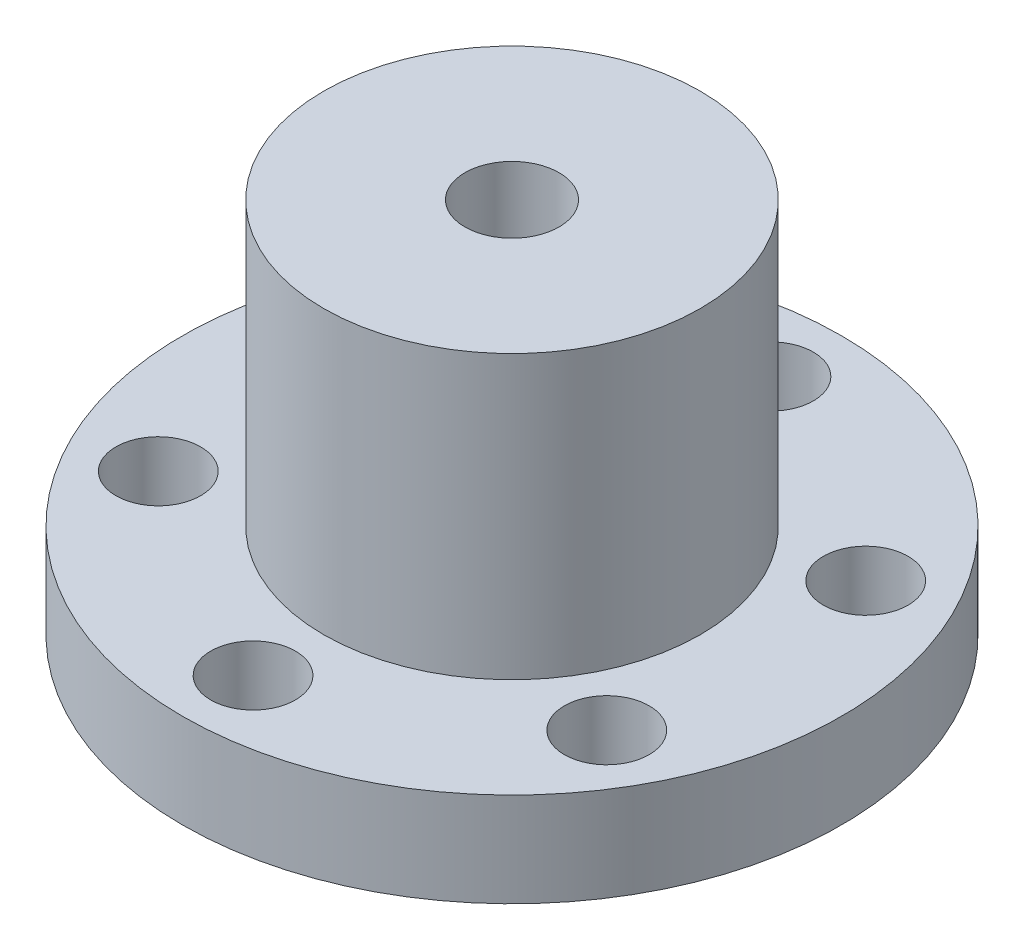
from build123d import *

# Parameters (mm, degrees)
SKETCH2_R           = 17.5
SKETCH2_R_2         = 2.25
BOSS_EXTRUDE1_DEPTH = 5
SKETCH3_R           = 10
BOSS_EXTRUDE2_DEPTH = 15
SKETCH4_R           = 2.5
CUT_EXTRUDE1_DEPTH  = 32.819805153


with BuildPart() as part:
    # Sketch2 → Boss-Extrude1 (new body)
    with BuildSketch(Plane(origin=(0, 0, 0), x_dir=(1, 0, 0), z_dir=(0, 1, 0))):
        with Locations(Location((0, 0, 0), (0, 0, 270))):
            Circle(SKETCH2_R)
        with Locations(Location((0, 13.75, 0), (0, 0, 270))):
            Circle(SKETCH2_R_2, mode=Mode.SUBTRACT)
        with Locations(Location((11.907849302, 6.875, 0), (0, 0, 270))):
            Circle(SKETCH2_R_2, mode=Mode.SUBTRACT)
        with Locations(Location((11.907849302, -6.875, 0), (0, 0, 270))):
            Circle(SKETCH2_R_2, mode=Mode.SUBTRACT)
        with Locations(Location((0, -13.75, 0), (0, 0, 270))):
            Circle(SKETCH2_R_2, mode=Mode.SUBTRACT)
        with Locations(Location((-11.907849302, -6.875, 0), (0, 0, 270))):
            Circle(SKETCH2_R_2, mode=Mode.SUBTRACT)
        with Locations(Location((-11.907849302, 6.875, 0), (0, 0, 270))):
            Circle(SKETCH2_R_2, mode=Mode.SUBTRACT)
    extrude(amount=BOSS_EXTRUDE1_DEPTH)

    # Sketch3 → Boss-Extrude2 (add)
    with BuildSketch(Plane(origin=(0, 5, 0), x_dir=(1, 0, 0), z_dir=(0, 1, 0))):
        with Locations(Location((0, 0, 0), (0, 0, 270))):
            Circle(SKETCH3_R)
    extrude(amount=BOSS_EXTRUDE2_DEPTH)

    # Sketch4 → Cut-Extrude1 (cut, through all)
    with BuildSketch(Plane(origin=(0, 20, 0), x_dir=(1, 0, 0), z_dir=(0, 1, 0))):
        with Locations(Location((0, 0, 0), (0, 0, 270))):
            Circle(SKETCH4_R)
    extrude(amount=-CUT_EXTRUDE1_DEPTH, mode=Mode.SUBTRACT)


solid = part.part
